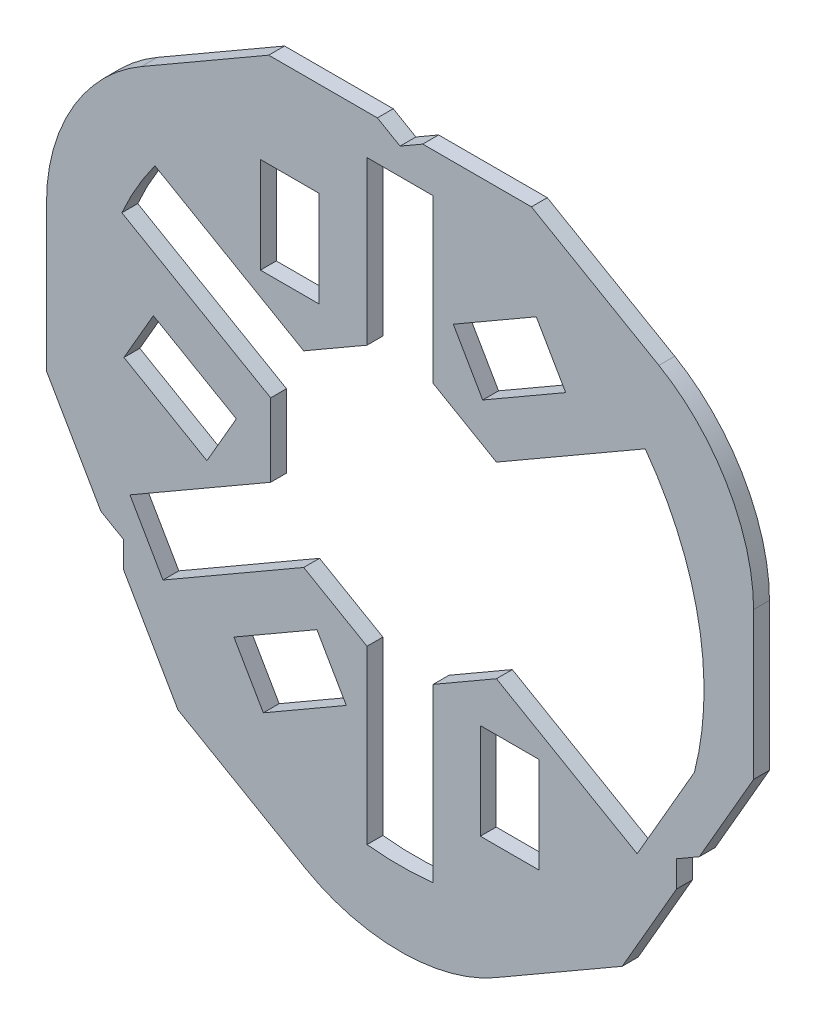
from build123d import *

# Parameters (mm, degrees)
BASE_DEPTH               = 1.2
PCB_SKETCH_W             = 4.450002
PCB_SKETCH_H             = 7.250001
PCB_COMPONENT_ROOM_DEPTH = 40.187510032
REMOVAL_ROOM_SIZE        = 1


with BuildPart() as part:
    # Base sketch → Base (new body)
    with BuildSketch(Plane.XY):
        with BuildLine():
            Line((22.639032554, -11.088045382), (26.75, -3.967640898))
            Line((26.75, -3.967640898), (26.75, 7.167640898))
            add(Edge.make_bspline(
                [(19.582359102, 19.582359102), (26.75, 15.444119701), (26.75, 7.167640898)],
                knots=[0, 0, 0, 1, 1, 1], degree=2, weights=[1, 0.818181818, 1]))
            Line((19.582359102, 19.582359102), (9.93892219, 25.15))
            Line((9.93892219, 25.15), (1.716987298, 25.15))
            Line((1.716987298, 25.15), (0, 24.158696921))
            Line((0, 24.158696921), (-1.716987298, 25.15))
            Line((-1.716987298, 25.15), (-9.93892219, 25.15))
            Line((-9.93892219, 25.15), (-19.582359102, 19.582359102))
            add(Edge.make_bspline(
                [(-19.582359102, 19.582359102), (-26.75, 15.444119701), (-26.75, 7.167640898)],
                knots=[0, 0, 0, 1, 1, 1], degree=2, weights=[1, 0.818181818, 1]))
            Line((-26.75, 7.167640898), (-26.75, -3.967640898))
            Line((-26.75, -3.967640898), (-22.639032554, -11.088045382))
            Line((-22.639032554, -11.088045382), (-20.922045256, -12.079348461))
            Line((-20.922045256, -12.079348461), (-20.922045256, -14.061954618))
            Line((-20.922045256, -14.061954618), (-16.81107781, -21.182359102))
            Line((-16.81107781, -21.182359102), (-7.167640898, -26.75))
            add(Edge.make_bspline(
                [(7.167640898, -26.75), (0, -30.888239402), (-7.167640898, -26.75)],
                knots=[0, 0, 0, 1, 1, 1], degree=2, weights=[1, 0.818181818, 1]))
            Line((7.167640898, -26.75), (16.81107781, -21.182359102))
            Line((16.81107781, -21.182359102), (20.922045256, -14.061954618))
            Line((20.922045256, -14.061954618), (20.922045256, -12.079348461))
            Line((20.922045256, -12.079348461), (22.639032554, -11.088045382))
        make_face()
    extrude(amount=BASE_DEPTH)

    # PCB sketch → PCB Component room (cut, through all)
    with BuildSketch(Plane.XY):
        with BuildLine():
            Line((7.292235248, -7.096920387), (17.939993848, -13.244411362))
            Line((17.939993848, -13.244411362), (22.271882405, -5.741366))
            ThreePointArc((22.271882405, -5.741366), (22.585630976, 4.346215175), (18.550568269, 13.596944935))
            Line((18.550568269, 13.596944935), (7.292237734, 7.096945429))
            Line((7.292237734, 7.096945429), (2.500009052, 9.863735785))
            Line((2.500009052, 9.863735785), (2.500009052, 22.158696921))
            Line((2.500009052, 22.158696921), (-2.499990948, 22.158696921))
            Line((-2.499990948, 22.158696921), (-2.499990948, 9.863735785))
            Line((-2.499990948, 9.863735785), (-7.292227753, 7.096933454))
            Line((-7.292227753, 7.096933454), (-18.550555859, 13.596937166))
            ThreePointArc((-18.550555859, 13.596937166), (-19.91857187, 11.500010223), (-21.050555597, 9.266809996))
            Line((-21.050555597, 9.266809996), (-9.792227491, 2.766806284))
            Line((-9.792227491, 2.766806284), (-9.792228638, -2.766774829))
            Line((-9.792228638, -2.766774829), (-20.440003139, -8.91426968))
            Line((-20.440003139, -8.91426968), (-17.940003329, -13.244396808))
            Line((-17.940003329, -13.244396808), (-7.29223057, -7.096902963))
            Line((-7.29223057, -7.096902963), (-2.499990948, -9.863708244))
            Line((-2.499990948, -9.863708244), (-2.499990948, -22.863708244))
            ThreePointArc((-2.499990948, -22.863708244), (9.052e-06, -22.999981541), (2.500009052, -22.863708244))
            Line((2.500009052, -22.863708244), (2.500009052, -9.863708244))
            Line((2.500009052, -9.863708244), (7.292235248, -7.096920387))
        make_face()
        Polygon((-12.572606222, -14.297562646), (-10.347605222, -18.151377424), (-4.068920179, -14.526376924), (-6.293921179, -10.672562146), align=None)
        with Locations((8.300001248, -14.39998027)):
            Rectangle(PCB_SKETCH_W, PCB_SKETCH_H)
        Polygon((-18.668370671, 3.71544734), (-20.893371671, -0.138367439), (-14.614686627, -3.763367939), (-12.389685627, 0.09044684), align=None)
        with Locations((-8.341529649, 14.3760387)):
            Rectangle(PCB_SKETCH_W, PCB_SKETCH_H)
        Polygon((12.531077821, 14.273621076), (10.306076821, 18.127435854), (4.027391778, 14.502435354), (6.252392778, 10.648620576), align=None)
    extrude(amount=PCB_COMPONENT_ROOM_DEPTH, mode=Mode.SUBTRACT)

    # Removal room
    removal_room_edges = [part.edges().sort_by_distance(p)[0] for p in [
        (22.585630976, 4.346215175, 0),
    ]]
    chamfer(removal_room_edges, length=REMOVAL_ROOM_SIZE)


solid = part.part
